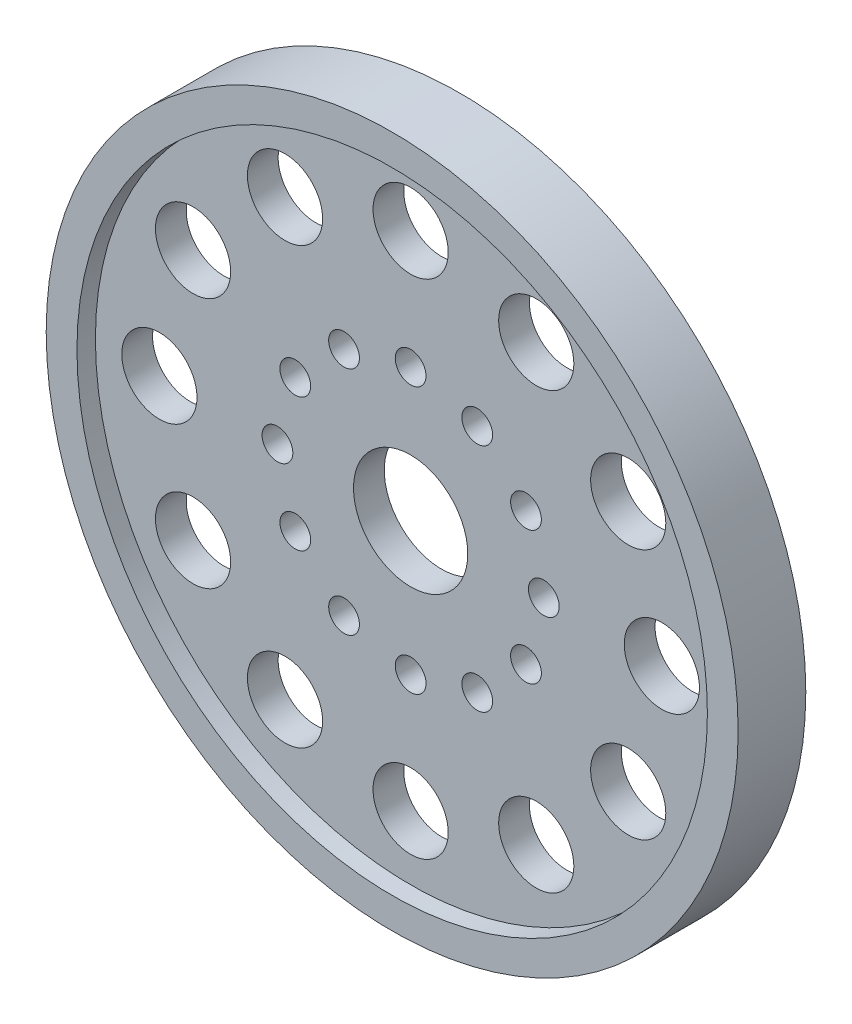
from build123d import *

# Parameters (mm, degrees)
SKETCH1_R               = 28.575
BOSS_EXTRUDE1_DEPTH     = 2.794
SKETCH2_R               = 4.71805
SKETCH2_R_2             = 1.27
CUT_EXTRUDE1_DEPTH      = 41.795673717
CUT_EXTRUDE2_START      = -1.27
SKETCH3_R               = 26.035
CUT_EXTRUDE2_DEPTH      = 1.651
CUT_EXTRUDE3_DEPTH      = 41.507625035
CUT_EXTRUDE3_DEPTH_BACK = 41.507625035
SKETCH4_R               = 3.10515


with BuildPart() as part:
    # Sketch1 → Boss-Extrude1 (new, symmetric)
    with BuildSketch(Plane.XY):
        Circle(SKETCH1_R)
    extrude(amount=BOSS_EXTRUDE1_DEPTH, both=True)

    # Sketch2 → Cut-Extrude1 (cut, through all)
    with BuildSketch(Plane.XY.offset(2.794)):
        Circle(SKETCH2_R)
        with Locations((0, 11)):
            Circle(SKETCH2_R_2)
        with Locations((5.500133975, 9.526779442)):
            Circle(SKETCH2_R_2)
        with Locations((9.526779442, 5.500866025)):
            Circle(SKETCH2_R_2)
        with Locations((11.001, 0.001)):
            Circle(SKETCH2_R_2)
        with Locations((9.527779442, -5.499133975)):
            Circle(SKETCH2_R_2)
        with Locations((5.501866025, -9.525779442)):
            Circle(SKETCH2_R_2)
        with Locations((0.002, -11)):
            Circle(SKETCH2_R_2)
        with Locations((-5.498133975, -9.526779442)):
            Circle(SKETCH2_R_2)
        with Locations((-9.524779442, -5.500866025)):
            Circle(SKETCH2_R_2)
        with Locations((-10.999, -0.001)):
            Circle(SKETCH2_R_2)
        with Locations((-9.525779442, 5.499133975)):
            Circle(SKETCH2_R_2)
        with Locations((-5.499866025, 9.525779442)):
            Circle(SKETCH2_R_2)
    extrude(amount=-CUT_EXTRUDE1_DEPTH, mode=Mode.SUBTRACT)

    # Sketch3 → Cut-Extrude2 (cut)
    with BuildSketch(Plane.XY.offset(CUT_EXTRUDE2_START)):
        Circle(SKETCH3_R)
    cut_extrude2 = extrude(amount=-CUT_EXTRUDE2_DEPTH, mode=Mode.SUBTRACT)

    # Mirror1: Cut-Extrude2 across plane
    add(cut_extrude2.mirror(Plane.XY), mode=Mode.SUBTRACT)

    # Sketch4 → Cut-Extrude3 (cut, two sides: drawn at the far end of the back side and taken through both)
    with BuildSketch(Plane.XY.offset(-CUT_EXTRUDE3_DEPTH_BACK)):
        with Locations((0, 20.75)):
            Circle(SKETCH4_R)
        with Locations((10.375, 17.970027129)):
            Circle(SKETCH4_R)
        with Locations((17.970027129, 10.375)):
            Circle(SKETCH4_R)
        with Locations((20.75, 0)):
            Circle(SKETCH4_R)
        with Locations((17.970027129, -10.375)):
            Circle(SKETCH4_R)
        with Locations((10.375, -17.970027129)):
            Circle(SKETCH4_R)
        with Locations((0, -20.75)):
            Circle(SKETCH4_R)
        with Locations((-10.375, -17.970027129)):
            Circle(SKETCH4_R)
        with Locations((-17.970027129, -10.375)):
            Circle(SKETCH4_R)
        with Locations((-20.75, 0)):
            Circle(SKETCH4_R)
        with Locations((-17.970027129, 10.375)):
            Circle(SKETCH4_R)
        with Locations((-10.375, 17.970027129)):
            Circle(SKETCH4_R)
    extrude(amount=CUT_EXTRUDE3_DEPTH + CUT_EXTRUDE3_DEPTH_BACK, mode=Mode.SUBTRACT)


solid = part.part
